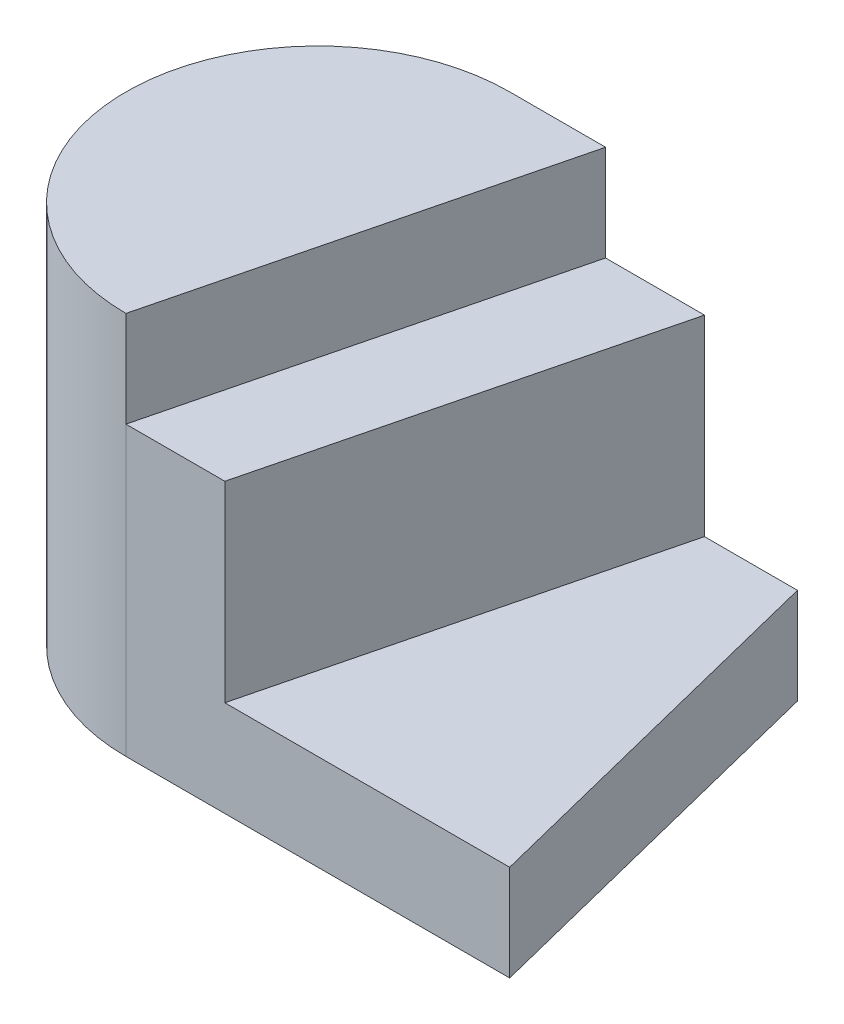
from build123d import *

# Parameters (mm, degrees)
EXTRUDE_1_DEPTH = 10
EXTRUDE_START   = 30
EXTRUDE_2_DEPTH = 30
EXTRUDE_3_DEPTH = 20


with BuildPart() as part:
    # 草圖1 → 填料-伸長1 (new body)
    with BuildSketch(Plane(origin=(0, 0, 0), x_dir=(1, 0, 0), z_dir=(0, 1, 0))):
        with BuildLine():
            Line((0, -20), (40, -20))
            Line((40, -20), (30, 20))
            Line((30, 20), (0, 20))
            ThreePointArc((0, 20), (-20, 0), (0, -20))
        make_face()
    extrude(amount=-EXTRUDE_1_DEPTH)

    # 草圖2 → 填料-伸長2 (add)
    with BuildSketch(Plane(origin=(0, 0, 0), x_dir=(1, 0, 0), z_dir=(0, 1, 0)).offset(EXTRUDE_START)):
        with BuildLine():
            Line((10, 20), (0, 20))
            ThreePointArc((0, 20), (-20, 0), (0, -20))
            Line((0, -20), (10, 20))
        make_face()
    extrude(amount=-EXTRUDE_2_DEPTH)

    # 草圖2<3> → 填料-伸長3 (add)
    with BuildSketch(Plane(origin=(0, 0, 0), x_dir=(1, 0, 0), z_dir=(0, 1, 0))):
        Polygon((20.307764064, 20), (10, 20), (0, -20), (10.307764064, -20), align=None)
    extrude(amount=EXTRUDE_3_DEPTH)


solid = part.part
